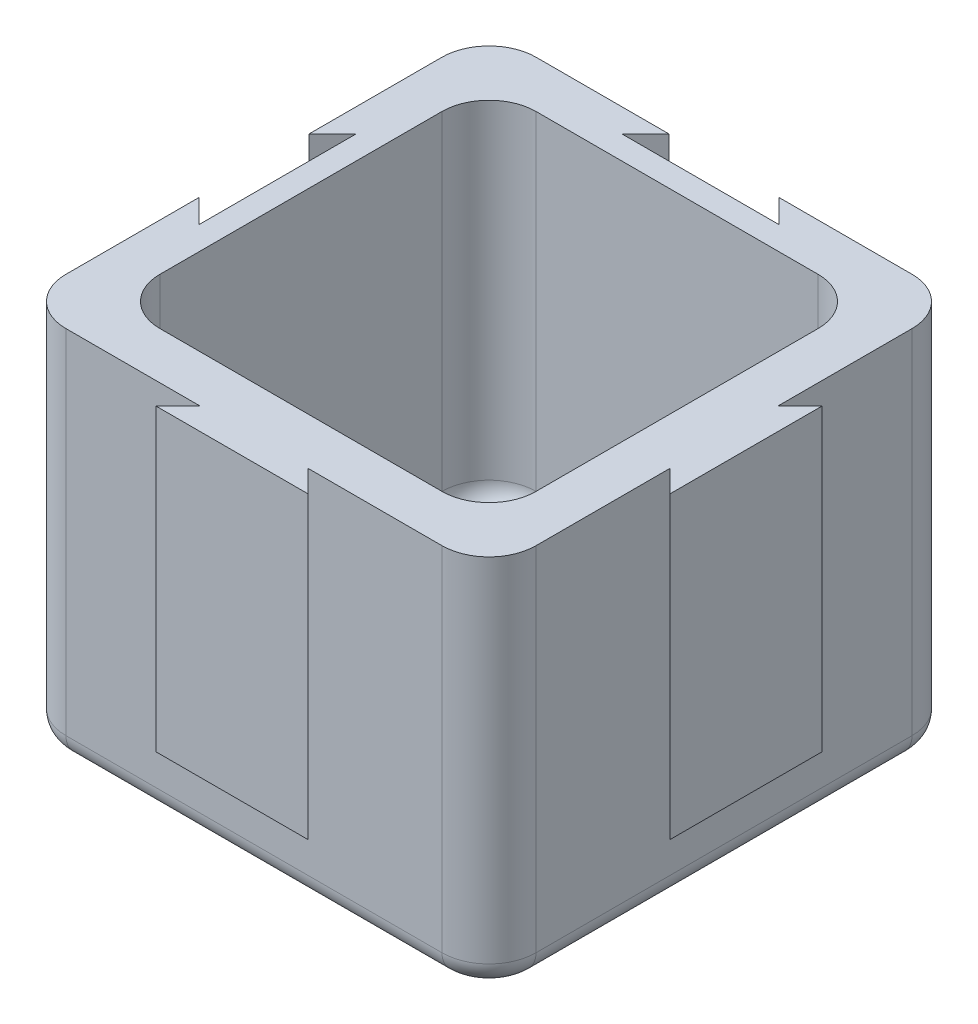
from build123d import *

# Parameters (mm, degrees)
SKETCH1_W                 = 100
SKETCH1_H                 = 100
BOSS_EXTRUDE1_DEPTH       = 80
SHELL1_T                  = -10
SHELL1_THICKNESS_2_FACE_W = 80
SHELL1_THICKNESS_2_FACE_H = 80
SHELL1_THICKNESS_2_DEPTH  = 5
CUT_EXTRUDE1_DEPTH        = 64
BOSS_EXTRUDE2_DEPTH       = 63.7
CUT_EXTRUDE2_DEPTH        = 64
BOSS_EXTRUDE3_DEPTH       = 63.7
FILLET1_R                 = 10
FILLET2_R                 = 5


with BuildPart() as part:
    # Sketch1 → Boss-Extrude1 (new body)
    with BuildSketch(Plane(origin=(0, 0, 0), x_dir=(1, 0, 0), z_dir=(0, 1, 0))):
        Rectangle(SKETCH1_W, SKETCH1_H)
    extrude(amount=BOSS_EXTRUDE1_DEPTH)

    # Shell1
    shell1_openings = [part.faces().sort_by_distance(p)[0] for p in [
        (0, 80, 0),
    ]]
    offset(amount=SHELL1_T, openings=shell1_openings, kind=Kind.INTERSECTION)

    # Shell1 thickness 2 face (on inner face of the shell) → Shell1 thickness 2 (cut)
    with BuildSketch(Plane(origin=(0, 10, 0), x_dir=(0, 0, -1), z_dir=(0, -1, 0))):
        Rectangle(SHELL1_THICKNESS_2_FACE_W, SHELL1_THICKNESS_2_FACE_H)
    extrude(amount=SHELL1_THICKNESS_2_DEPTH, mode=Mode.SUBTRACT)

    # Sketch2 → Cut-Extrude1 (cut)
    with BuildSketch(Plane(origin=(0, 80, 0), x_dir=(1, 0, 0), z_dir=(0, 1, 0))):
        Polygon((-11.666666667, 50), (-16.666666667, 45), (16.666666667, 45), (11.666666667, 50), align=None)
    extrude(amount=-CUT_EXTRUDE1_DEPTH, mode=Mode.SUBTRACT)

    # Sketch3 → Boss-Extrude2 (add)
    with BuildSketch(Plane(origin=(0, 80, 0), x_dir=(1, 0, 0), z_dir=(0, 1, 0))):
        Polygon((-11.454534632, -50), (-16.154534632, -54.7), (16.154534632, -54.7), (11.454534632, -50), align=None)
    extrude(amount=-BOSS_EXTRUDE2_DEPTH)

    # Sketch4 → Cut-Extrude2 (cut)
    with BuildSketch(Plane(origin=(0, 80, 0), x_dir=(1, 0, 0), z_dir=(0, 1, 0))):
        Polygon((-45, 16.666666667), (-45, -16.666666667), (-50, -11.666666667), (-50, 11.666666667), align=None)
    extrude(amount=-CUT_EXTRUDE2_DEPTH, mode=Mode.SUBTRACT)

    # Sketch5 → Boss-Extrude3 (add)
    with BuildSketch(Plane(origin=(0, 80, 0), x_dir=(1, 0, 0), z_dir=(0, 1, 0))):
        Polygon((50, 11.454534632), (50, -11.454534632), (54.7, -16.154534632), (54.7, 16.154534632), align=None)
    extrude(amount=-BOSS_EXTRUDE3_DEPTH)

    # Fillet1
    fillet1_edges = [part.edges().sort_by_distance(p)[0] for p in [
        (40, 42.5, 40),
        (40, 42.5, -40),
        (-40, 42.5, -40),
        (-40, 42.5, 40),
        (50, 40, 50),
        (-50, 40, 50),
        (-50, 40, -50),
        (50, 40, -50),
    ]]
    fillet(fillet1_edges, radius=FILLET1_R)

    # Fillet2
    fillet2_edges = [part.edges().sort_by_distance(p)[0] for p in [
        (50, 0, 0),
        (0, 0, 50),
        (-50, 0, 0),
        (47.071067812, 0, 47.071067812),
        (-47.071067812, 0, 47.071067812),
        (-47.071067812, 0, -47.071067812),
        (47.071067812, 0, -47.071067812),
        (40, 5, 0),
        (0, 5, -40),
        (-40, 5, 0),
        (0, 5, 40),
        (37.071067812, 5, 37.071067812),
        (-37.071067812, 5, 37.071067812),
        (-37.071067812, 5, -37.071067812),
        (37.071067812, 5, -37.071067812),
        (0, 0, -50),
    ]]
    fillet(fillet2_edges, radius=FILLET2_R)


solid = part.part
